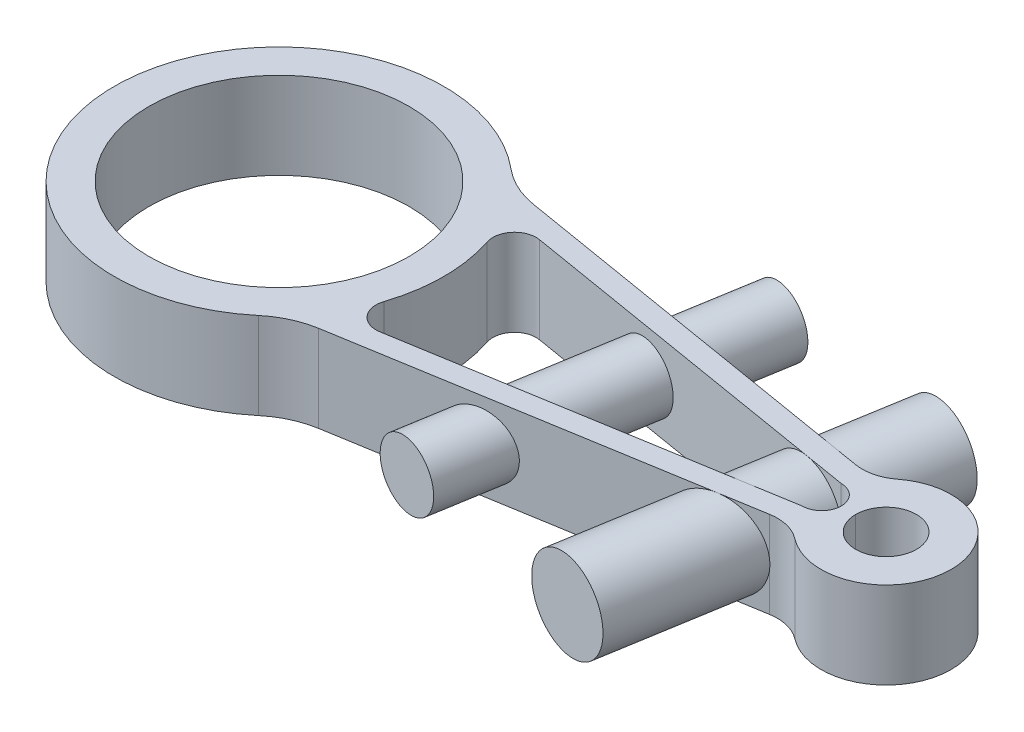
from build123d import *

# Parameters (mm, degrees)
SKETCH1_R                = 30
SKETCH1_R_2              = 7
BOSS_EXTRUDE1_DEPTH      = 10
FILLET1_R                = 10
FILLET2_R                = 20
CUT_EXTRUDE1_DEPTH       = 10
BOSS_EXTRUDE4_DEPTH      = 48
BOSS_EXTRUDE4_DEPTH_BACK = 27
SKETCH3_R                = 10
SKETCH3_R_2              = 7.5


with BuildPart() as part:
    # Sketch1 → Boss-Extrude1 (new, symmetric)
    with BuildSketch(Plane(origin=(0, 0, 0), x_dir=(1, 0, 0), z_dir=(0, 1, 0))):
        with BuildLine():
            Line((27.935473676, -25.760615491), (128.063755469, -9.084385863))
            ThreePointArc((128.063755469, -9.084385863), (155, 0), (128.063755469, 9.084385863))
            Line((128.063755469, 9.084385863), (27.935473676, 25.760615491))
            ThreePointArc((27.935473676, 25.760615491), (-38, 0), (27.935473676, -25.760615491))
        make_face()
        with Locations(Location((0, 0, 0), (0, 0, 270))):
            Circle(SKETCH1_R, mode=Mode.SUBTRACT)
        with Locations(Location((140, 0, 0), (0, 0, 270))):
            Circle(SKETCH1_R_2, mode=Mode.SUBTRACT)
    extrude(amount=BOSS_EXTRUDE1_DEPTH, both=True)

    # Fillet1
    fillet1_edges = [part.edges().sort_by_distance(p)[0] for p in [
        (128.063755469, 0, -9.084385863),
        (128.063755469, 0, 9.084385863),
    ]]
    fillet(fillet1_edges, radius=FILLET1_R)

    # Fillet2
    fillet2_edges = [part.edges().sort_by_distance(p)[0] for p in [
        (27.935473676, 0, -25.760615491),
        (27.935473676, 0, 25.760615491),
    ]]
    fillet(fillet2_edges, radius=FILLET2_R)

    # Sketch2 → Cut-Extrude1 (cut)
    with BuildSketch(Plane(origin=(0, 10, 0), x_dir=(1, 0, 0), z_dir=(0, 1, 0))):
        with BuildLine():
            Line((41.655668603, 18.406663826), (125.154779936, 4.5))
            ThreePointArc((125.154779936, 4.5), (129.654779936, 0), (125.154779936, -4.5))
            Line((125.154779936, -4.5), (41.655668603, -18.406663826))
            ThreePointArc((41.655668603, -18.406663826), (37.03770568, -16.72826346), (36.086072586, -11.907785911))
            ThreePointArc((36.086072586, -11.907785911), (38, 0), (36.086072586, 11.907785911))
            ThreePointArc((36.086072586, 11.907785911), (37.03770568, 16.72826346), (41.655668603, 18.406663826))
        make_face()
    cut_extrude1 = extrude(amount=-CUT_EXTRUDE1_DEPTH, mode=Mode.SUBTRACT)

    # Mirror1: Cut-Extrude1 across plane
    add(cut_extrude1.mirror(Plane.ZX), mode=Mode.SUBTRACT)

    # Sketch3 → Boss-Extrude4 (add, two sides: drawn at the far end of the back side and taken through both)
    with BuildSketch(Plane(origin=(4.107142857, 0, -24.6603199), x_dir=(0.9864127959843347, 0, 0.16428571428571412), z_dir=(-0.16428571428571412, 0, 0.9864127959843348)).offset(-BOSS_EXTRUDE4_DEPTH_BACK)):
        with Locations(Location((113.065732621, 0, 0), (0, 0, 270))):
            Circle(SKETCH3_R)
        with Locations(Location((68.065732621, 0, 0), (0, 0, 180))):
            Circle(SKETCH3_R_2)
    extrude(amount=BOSS_EXTRUDE4_DEPTH + BOSS_EXTRUDE4_DEPTH_BACK)


solid = part.part
